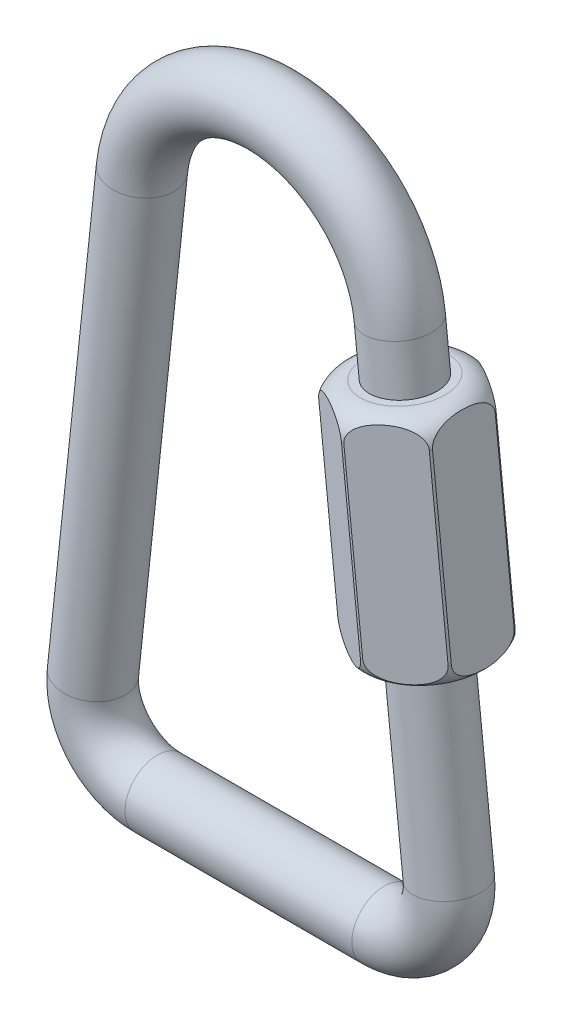
from build123d import *

# Parameters (mm, degrees)
SKETCH1_R           = 2
BOSS_EXTRUDE1_START = -3
BOSS_EXTRUDE1_DEPTH = 14


with BuildPart() as part:
    # Sweep1: sweep along a path in Sketch2
    with BuildLine(Plane.XY) as sweep1_path:
        Line((0, 0), (-14, 0))
        ThreePointArc((-14, 0), (-16.974210855, 1.325290709), (-17.977574703, 4.422965104))
        Line((-17.977574703, 4.422965104), (-14.955149407, 32.845930209))
        ThreePointArc((-14.955149407, 32.845930209), (-7, 40), (0.955149407, 32.845930209))
        Line((0.955149407, 32.845930209), (3.977574703, 4.422965104))
        ThreePointArc((3.977574703, 4.422965104), (2.974210855, 1.325290709), (0, 0))
    # Sketch1 → Sweep1 (sweep)
    with BuildSketch(Plane(origin=(0, 0, 0), x_dir=(0, 0, -1), z_dir=(1, 0, 0))):
        Circle(SKETCH1_R)
    sweep(path=sweep1_path.line)

    # Sketch3 → Boss-Extrude1 (add)
    with BuildSketch(Plane(origin=(0.955149407, 32.845930209, 0), x_dir=(-0.9943936758290052, -0.10574127610010836, 0), z_dir=(-0.10574127610010836, 0.9943936758290052, 0)).offset(BOSS_EXTRUDE1_START)):
        Polygon((-3.5, 2.020725942), (-3.5, -2.020725942), (0, -4.041451884), (3.5, -2.020725942), (3.5, 2.020725942), (0, 4.041451884), align=None)
    extrude(amount=-BOSS_EXTRUDE1_DEPTH)

    # Sketch4 → Cut-Revolve1 (revolve, cut)
    with BuildSketch(Plane.XY):
        with BuildLine():
            Line((5.408559852, 28.794123772), (6.571713889, 17.855793338))
            ThreePointArc((6.571713889, 17.855793338), (6.246992703, 16.754623217), (5.23873529, 16.20559091))
            Line((5.23873529, 16.20559091), (5.408559852, 15.997851403))
            Line((5.408559852, 15.997851403), (9.687431561, 16.483117418))
            Line((9.687431561, 16.483117418), (7.699236532, 34.014185327))
            Line((7.699236532, 34.014185327), (3.310720243, 33.417080039))
            Line((3.310720243, 33.417080039), (3.758357425, 30.127102372))
            ThreePointArc((3.758357425, 30.127102372), (4.859527546, 29.802381185), (5.408559852, 28.794123772))
        make_face()
    revolve(axis=Axis((3.977574703, 4.422965104, 0), (-0.10574127610010838, 0.9943936758290052, 0)), mode=Mode.SUBTRACT)


solid = part.part
